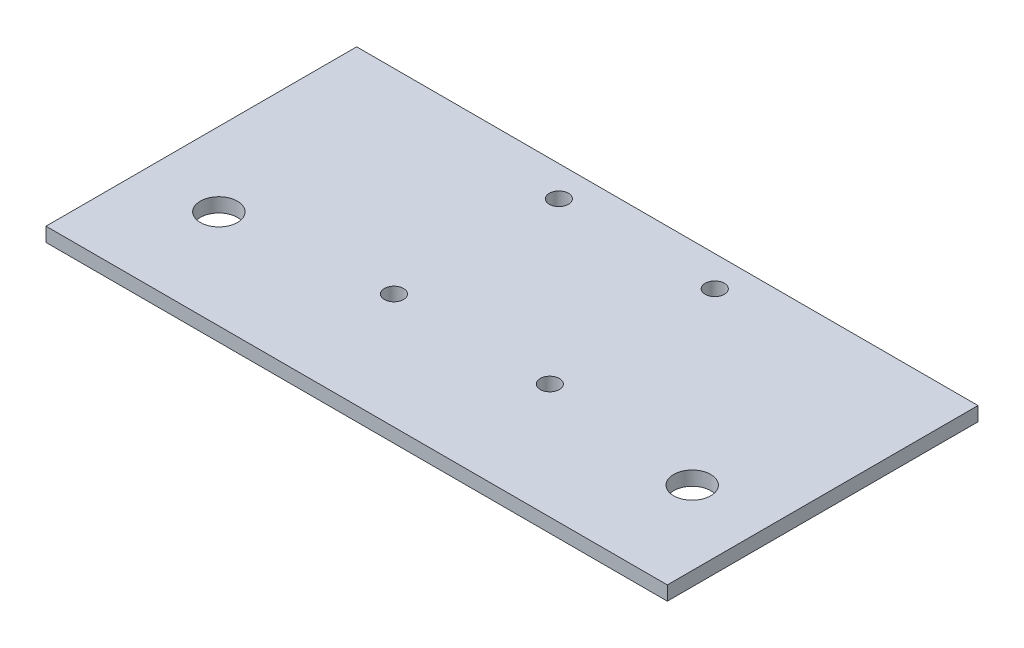
from build123d import *

# Parameters (mm, degrees)
SKETCH1_W           = 139.7
SKETCH1_H           = 69.85
SKETCH1_R           = 2.159
SKETCH1_R_2         = 4.1656
BOSS_EXTRUDE1_DEPTH = 3.175


with BuildPart() as part:
    # Sketch1 → Boss-Extrude1 (new body)
    with BuildSketch(Plane(origin=(0, 0, 0), x_dir=(1, 0, 0), z_dir=(0, 1, 0))):
        with Locations((17.526, -28.067)):
            Rectangle(SKETCH1_W, SKETCH1_H)
        with Locations(Location((0, 0, 0), (0, 0, 270))):
            Circle(SKETCH1_R, mode=Mode.SUBTRACT)
        with Locations(Location((35.052, 0, 0), (0, 0, 270))):
            Circle(SKETCH1_R, mode=Mode.SUBTRACT)
        with Locations(Location((0, -37.084, 0), (0, 0, 270))):
            Circle(SKETCH1_R, mode=Mode.SUBTRACT)
        with Locations(Location((35.052, -37.084, 0), (0, 0, 270))):
            Circle(SKETCH1_R, mode=Mode.SUBTRACT)
        with Locations(Location((-35.687, -40.767, 0), (0, 0, 270))):
            Circle(SKETCH1_R_2, mode=Mode.SUBTRACT)
        with Locations(Location((70.739, -40.767, 0), (0, 0, 270))):
            Circle(SKETCH1_R_2, mode=Mode.SUBTRACT)
    extrude(amount=BOSS_EXTRUDE1_DEPTH)


solid = part.part
